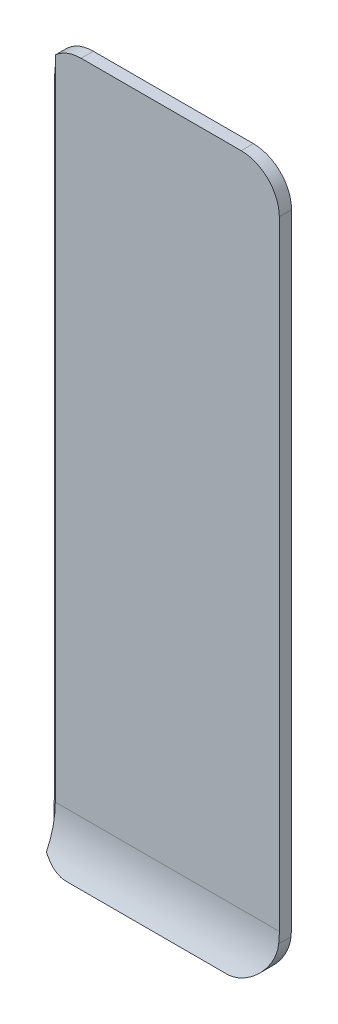
from build123d import *

# Parameters (mm, degrees)
BOSS_EXTRUDE1_DEPTH = 70
CUT_EXTRUDE1_DEPTH  = 1951.170505366
CUT_EXTRUDE2_DEPTH  = 32.5


with BuildPart() as part:
    # Sketch1 → Boss-Extrude1 (new body)
    with BuildSketch(Plane.XY):
        with BuildLine():
            Line((100, 0), (519, 0))
            ThreePointArc((519, 0), (589.710678119, 29.289321881), (619, 100))
            Line((619, 100), (619, 1748))
            ThreePointArc((619, 1748), (589.710678119, 1818.710678119), (519, 1848))
            Line((519, 1848), (100, 1848))
            ThreePointArc((100, 1848), (29.289321881, 1818.710678119), (0, 1748))
            Line((0, 1748), (0, 100))
            ThreePointArc((0, 100), (29.289321881, 29.289321881), (100, 0))
        make_face()
    extrude(amount=BOSS_EXTRUDE1_DEPTH)

    # Sketch2 → Cut-Extrude1 (cut, through all)
    with BuildSketch(Plane.ZY):
        with BuildLine():
            Line((70, 1848), (32, 1848))
            Line((32, 1848), (32, 127.446930132))
            ThreePointArc((32, 127.446930132), (41.702246447, 60.951215984), (70, 0))
            Line((70, 0), (70, 1848))
        make_face()
        with BuildLine():
            Line((0, 0), (32.698538924, 0))
            ThreePointArc((32.698538924, 0), (8.304907254, 61.659555872), (0, 127.446930132))
            Line((0, 127.446930132), (0, 0))
        make_face()
    extrude(amount=-CUT_EXTRUDE1_DEPTH, mode=Mode.SUBTRACT)

    # Sketch4 → Cut-Extrude2 (cut)
    with BuildSketch(Plane.ZY):
        with BuildLine():
            Line((1, 1848), (32, 1848))
            Line((32, 1848), (32, 127.446930132))
            ThreePointArc((32, 127.446930132), (41.702246447, 60.951215984), (70, 0))
            Line((70, 0), (33.840121275, 0))
            ThreePointArc((33.840121275, 0), (9.341966472, 61.641927348), (1, 127.446930132))
            Line((1, 127.446930132), (1, 1848))
        make_face()
    extrude(amount=-CUT_EXTRUDE2_DEPTH, mode=Mode.SUBTRACT)


solid = part.part
